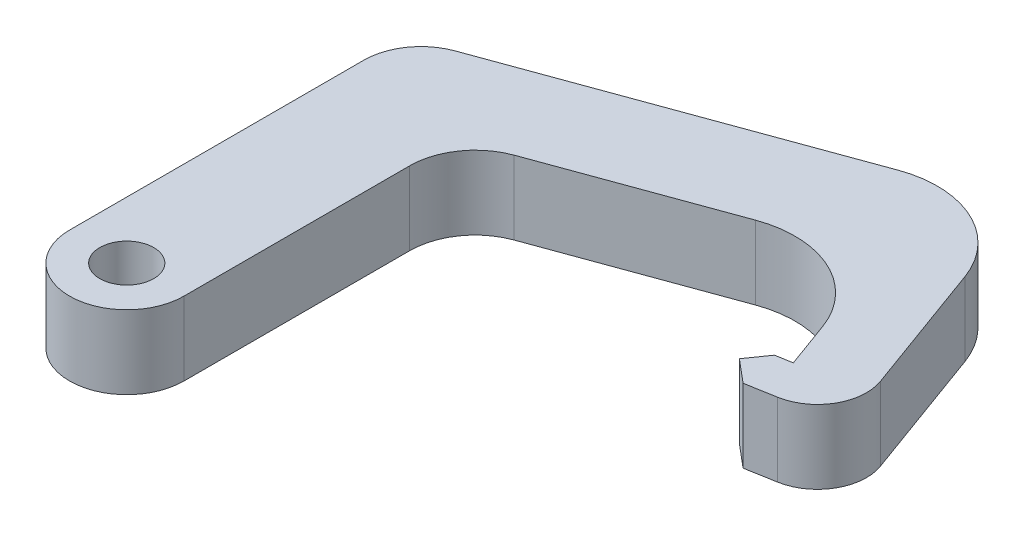
from build123d import *

# Parameters (mm, degrees)
SKETCH1_R           = 1.65
BOSS_EXTRUDE1_DEPTH = 4.5
FILLET1_R           = 4
FILLET2_R           = 6
FILLET3_R           = 3
CHAMFER1_SIZE       = 2
CHAMFER1_SIZE2      = 1.419615628


with BuildPart() as part:
    # Sketch1 → Boss-Extrude1 (new body)
    # profile 1 of 2: a face of its own
    with BuildSketch(Plane(origin=(0, 0, 0), x_dir=(1, 0, 0), z_dir=(0, 1, 0))):
        with BuildLine():
            Line((3.5, 0), (3.5, 18))
            ThreePointArc((3.5, 18), (0, 21.5), (-3.5, 18))
            Line((-3.5, 18), (-3.5, 0))
            ThreePointArc((-3.5, 0), (0, -3.5), (3.5, 0))
        make_face()
        with Locations(Location((0, 0, 0), (0, 0, 270))):
            Circle(SKETCH1_R, mode=Mode.SUBTRACT)
    # profile 2 of 2: a face of its own
    with BuildSketch(Plane(origin=(0, 0, 0), x_dir=(1, 0, 0), z_dir=(0, 1, 0))):
        with BuildLine():
            Line((24.303924048, 30.570527133), (-1.197070502, 21.288924173))
            ThreePointArc((-1.197070502, 21.288924173), (2.007517527, 20.867032155), (3.5, 18))
            Line((3.5, 18), (3.5, 16.613451389))
            Line((3.5, 16.613451389), (22.597274425, 23.564290835))
            Line((22.597274425, 23.564290835), (25.675455715, 15.107057248))
            Line((25.675455715, 15.107057248), (22.721032456, 14.586112715))
            Line((22.721032456, 14.586112715), (25.221032456, 12.488363637))
            Line((25.221032456, 12.488363637), (30.543696603, 13.426892935))
            Line((30.543696603, 13.426892935), (24.303924048, 30.570527133))
        make_face()
    extrude(amount=BOSS_EXTRUDE1_DEPTH)

    # Fillet1
    fillet1_edges = [part.edges().sort_by_distance(p)[0] for p in [
        (3.5, 2.25, -16.613451389),
    ]]
    fillet(fillet1_edges, radius=FILLET1_R)

    # Fillet2
    fillet2_edges = [part.edges().sort_by_distance(p)[0] for p in [
        (24.303924048, 2.25, -30.570527133),
        (22.597274425, 2.25, -23.564290835),
    ]]
    fillet(fillet2_edges, radius=FILLET2_R)

    # Fillet3
    fillet3_edges = [part.edges().sort_by_distance(p)[0] for p in [
        (30.543696603, 2.25, -13.426892935),
    ]]
    fillet(fillet3_edges, radius=FILLET3_R)

    # Chamfer1
    chamfer1_edges = [part.edges().sort_by_distance(p)[0] for p in [
        (22.721032456, 2.25, -14.586112715),
    ]]
    chamfer1_side = [part.faces().sort_by_distance(p)[0] for p in [
        (24.198244085, 2.25, -14.846584982),
    ]]
    chamfer(chamfer1_edges, length=CHAMFER1_SIZE, length2=CHAMFER1_SIZE2, reference=chamfer1_side[0])


solid = part.part
